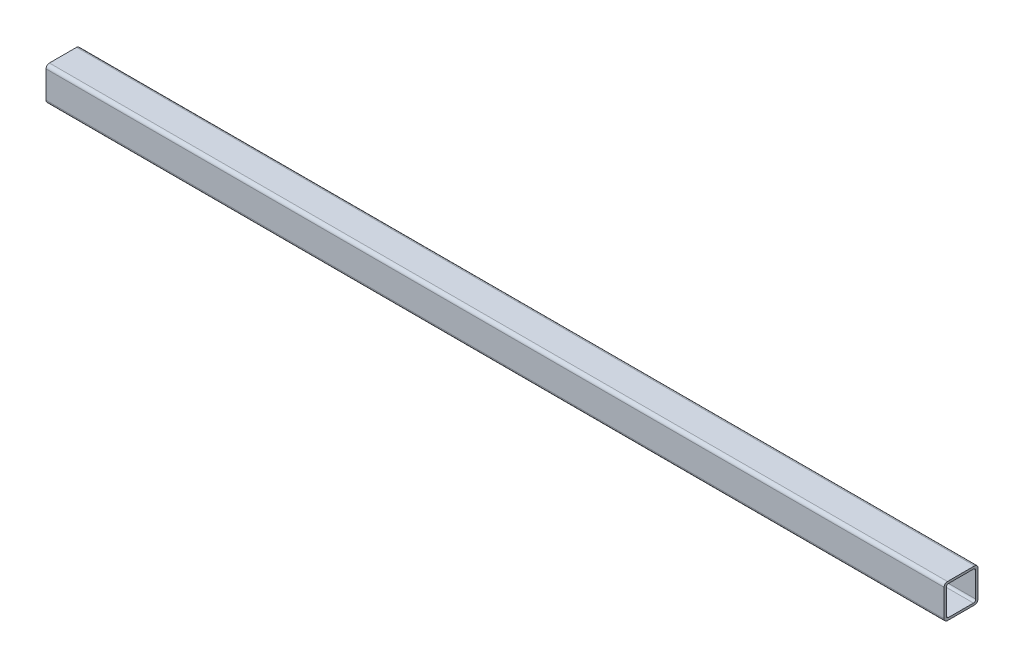
from build123d import *

# Parameters (mm, degrees)
EXTRUDE_1_DEPTH = 397


with BuildPart() as part:
    # Эскиз1 → Бобышка-Вытянуть1 (new body)
    with BuildSketch(Plane(origin=(0, 0, 0), x_dir=(0, 0, -1), z_dir=(1, 0, 0))):
        with BuildLine():
            Line((3, 30), (27, 30))
            ThreePointArc((27, 30), (29.121320344, 29.121320344), (30, 27))
            Line((30, 27), (30, 3))
            ThreePointArc((30, 3), (29.121320344, 0.878679656), (27, 0))
            Line((27, 0), (3, 0))
            ThreePointArc((3, 0), (0.878679656, 0.878679656), (0, 3))
            Line((0, 3), (0, 27))
            ThreePointArc((0, 27), (0.878679656, 29.121320344), (3, 30))
        make_face()
        with BuildLine():
            Line((4, 28), (26, 28))
            ThreePointArc((26, 28), (27.414213562, 27.414213562), (28, 26))
            Line((28, 26), (28, 4))
            ThreePointArc((28, 4), (27.414213562, 2.585786438), (26, 2))
            Line((26, 2), (4, 2))
            ThreePointArc((4, 2), (2.585786438, 2.585786438), (2, 4))
            Line((2, 4), (2, 26))
            ThreePointArc((2, 26), (2.585786438, 27.414213562), (4, 28))
        make_face(mode=Mode.SUBTRACT)
    extrude(amount=-EXTRUDE_1_DEPTH)

    # Зеркальное отражение2: part across plane


with BuildPart() as part_1:
    add(part.part)
    add(part.part.mirror(Plane(origin=(0, 3, -3), x_dir=(0, 0, 1), z_dir=(1, 0, 0))))


solid = part_1.part
